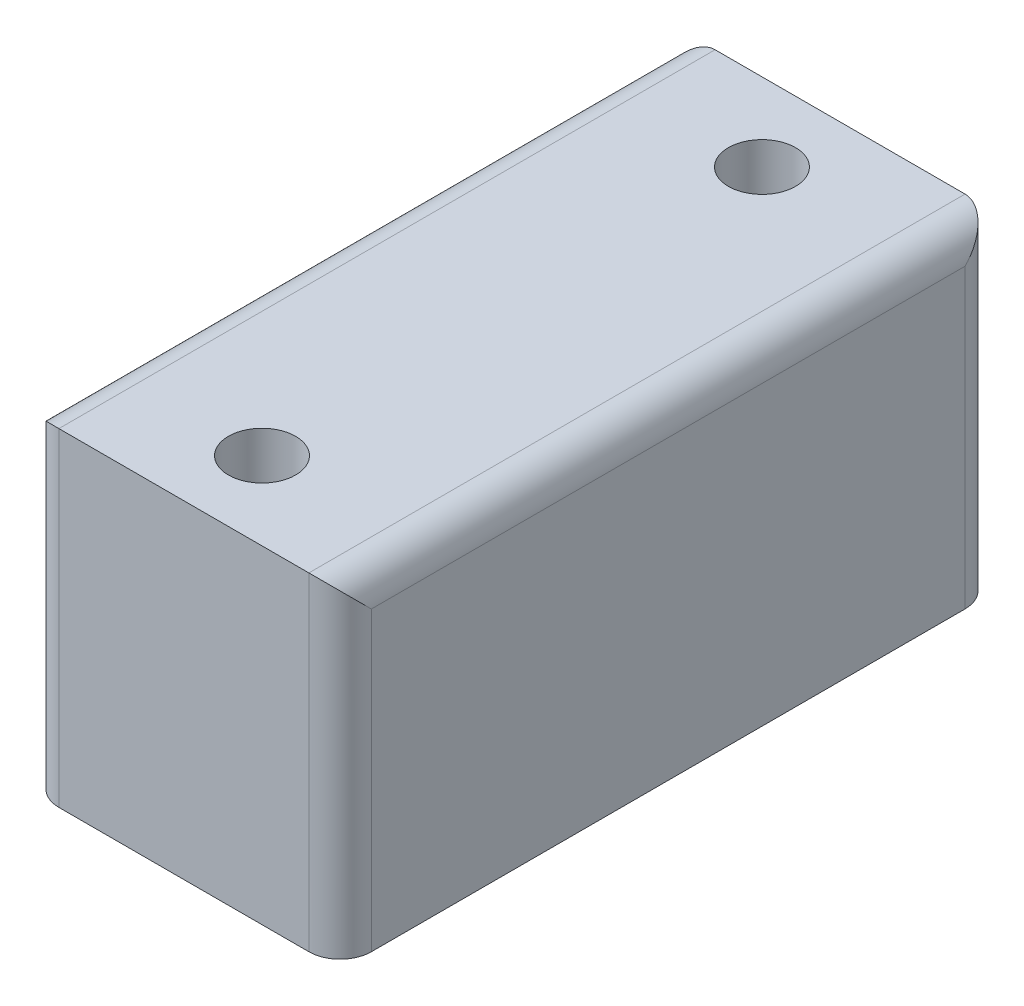
from build123d import *

# Parameters (mm, degrees)
SKETCH_1_W          = 20
SKETCH_1_H          = 21
EXTRUDE_1_DEPTH     = 42
CUT_EXTRUDE_1_REACH = 53.039
SKETCH_2_R          = 2.15
FILLET_1_R          = 2


with BuildPart() as part:
    # 草图1 → 凸台-拉伸1 (new body)
    with BuildSketch(Plane.XY):
        with Locations((-10, 10.5)):
            Rectangle(SKETCH_1_W, SKETCH_1_H)
    extrude(amount=EXTRUDE_1_DEPTH)

    # 草图2 → 切除-拉伸1 (cut, up to next)
    with BuildSketch(Plane(origin=(0, 21, 0), x_dir=(1, 0, 0), z_dir=(0, 1, 0)), mode=Mode.PRIVATE) as cut_extrude_1_sk1:
        with Locations(Location((-10, -5, 0), (0, 0, 180))):
            Circle(SKETCH_2_R)
    cut_extrude_1_tool1 = extrude(cut_extrude_1_sk1.sketch, amount=-CUT_EXTRUDE_1_REACH, mode=Mode.PRIVATE) & part.part
    # 草图2 → 切除-拉伸1 (cut, up to next)
    with BuildSketch(Plane(origin=(0, 21, 0), x_dir=(1, 0, 0), z_dir=(0, 1, 0)), mode=Mode.PRIVATE) as cut_extrude_1_sk2:
        with Locations(Location((-10, -37, 0), (0, 0, 180))):
            Circle(SKETCH_2_R)
    cut_extrude_1_tool2 = extrude(cut_extrude_1_sk2.sketch, amount=-CUT_EXTRUDE_1_REACH, mode=Mode.PRIVATE) & part.part
    add(cut_extrude_1_tool1.solids().sort_by_distance((-10, 21, 5))[0], mode=Mode.SUBTRACT)
    add(cut_extrude_1_tool2.solids().sort_by_distance((-10, 21, 37))[0], mode=Mode.SUBTRACT)

    # 圆角1
    fillet_1_edges = [part.edges().sort_by_distance(p)[0] for p in [
        (-20, 10.5, 42),
        (0, 10.5, 42),
        (-20, 10.5, 0),
        (0, 10.5, 0),
        (-20, 21, 21),
        (0, 21, 21),
    ]]
    fillet(fillet_1_edges, radius=FILLET_1_R)


solid = part.part
